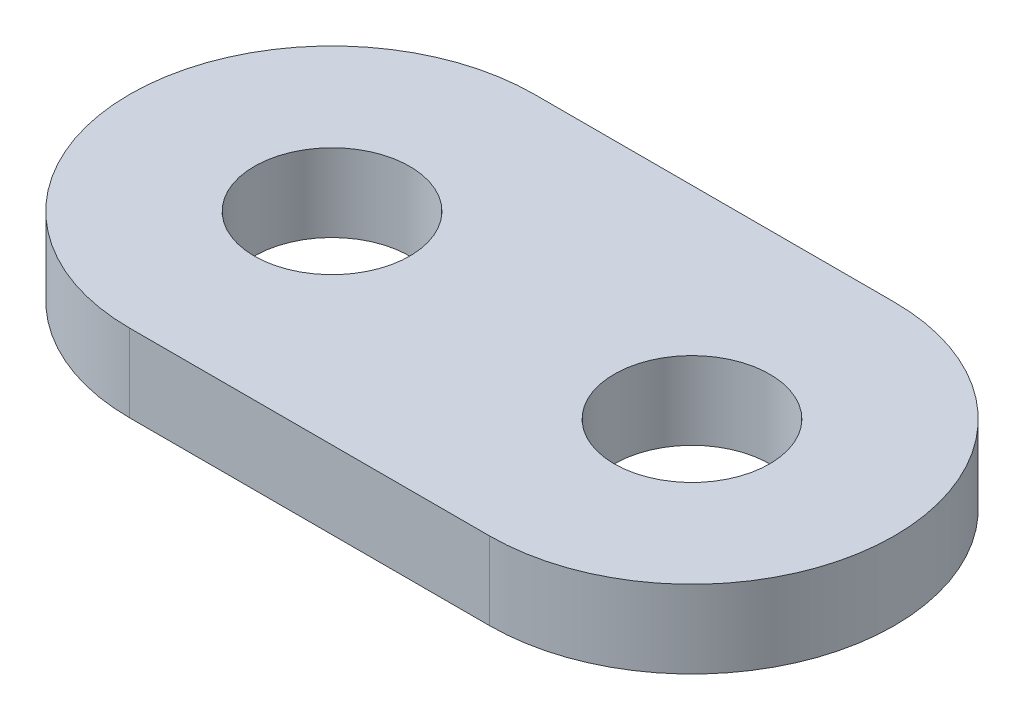
from build123d import *

# Parameters (mm, degrees)
SKETCH1_R           = 1.5875
BOSS_EXTRUDE2_DEPTH = 0.79375


with BuildPart() as part:
    # Sketch1 → Boss-Extrude2 (new, symmetric)
    with BuildSketch(Plane(origin=(0, 0, 0), x_dir=(1, 0, 0), z_dir=(0, 1, 0))):
        with BuildLine():
            Line((3.675, 4.133736316), (-3.675, 4.133736316))
            ThreePointArc((-3.675, 4.133736316), (-7.808736316, 0), (-3.675, -4.133736316))
            Line((-3.675, -4.133736316), (3.675, -4.133736316))
            ThreePointArc((3.675, -4.133736316), (7.808736316, 0), (3.675, 4.133736316))
        make_face()
        with Locations(Location((3.675, 0, 0), (0, 0, 270))):
            Circle(SKETCH1_R, mode=Mode.SUBTRACT)
        with Locations(Location((-3.675, 0, 0), (0, 0, 270))):
            Circle(SKETCH1_R, mode=Mode.SUBTRACT)
    extrude(amount=BOSS_EXTRUDE2_DEPTH, both=True)


solid = part.part
